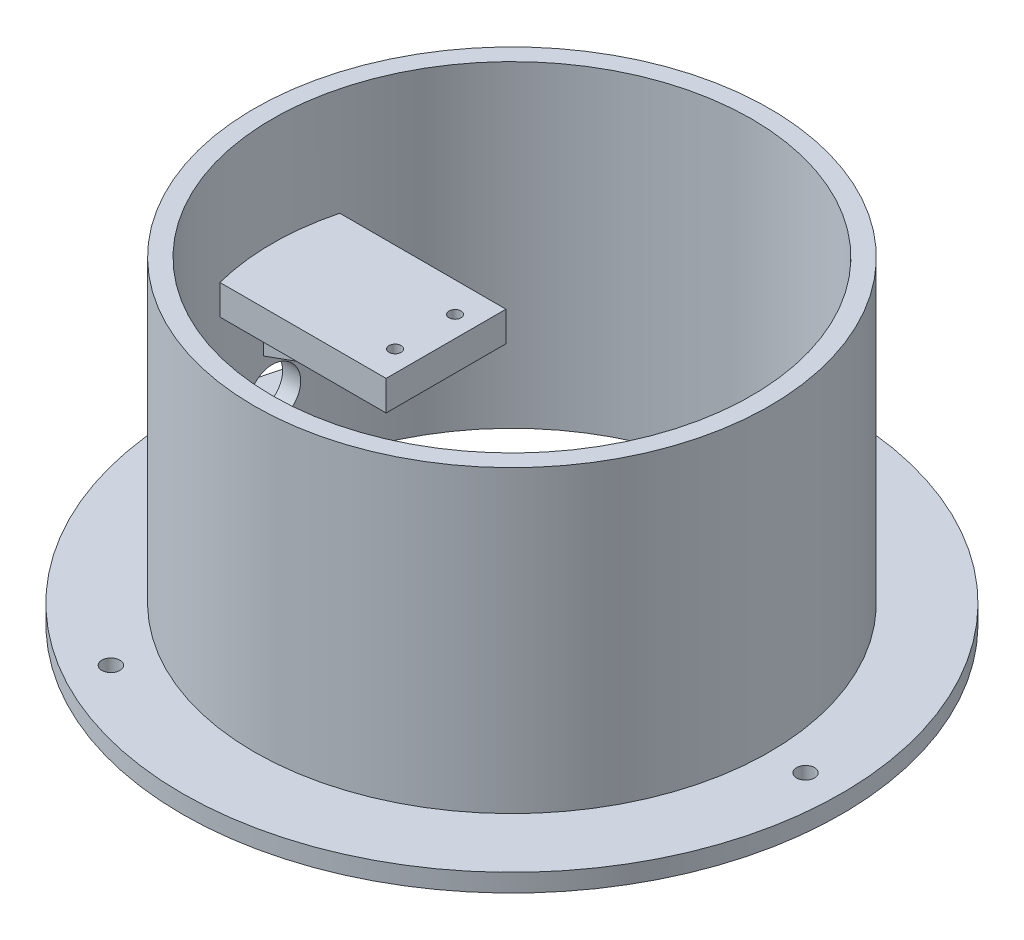
from build123d import *

# Parameters (mm, degrees)
SKETCH1_R           = 55
BOSS_EXTRUDE1_DEPTH = 3
SKETCH2_R           = 43
BOSS_EXTRUDE2_DEPTH = 50
SKETCH3_R           = 40
CUT_EXTRUDE1_DEPTH  = 66
SKETCH10_R          = 4.5
CUT_EXTRUDE2_DEPTH  = 9
BOSS_EXTRUDE4_DEPTH = 5
SKETCH17_W          = 10.5
SKETCH17_H          = 3
BOSS_EXTRUDE7_DEPTH = 10.5
CUT_EXTRUDE6_DEPTH  = 3
SKETCH19_W          = 29.5
SKETCH19_H          = 3
BOSS_EXTRUDE8_DEPTH = 10.5
CUT_EXTRUDE7_DEPTH  = 3
SKETCH21_R          = 1.5
CUT_EXTRUDE8_DEPTH  = 8
CIRPATTERN1_COUNT   = 3
SKETCH23_R          = 1
CUT_EXTRUDE9_DEPTH  = 9
SKETCH24_R          = 1
CUT_EXTRUDE10_DEPTH = 9


with BuildPart() as part:
    # Sketch1 → Boss-Extrude1 (new body)
    with BuildSketch(Plane(origin=(0, 0, 0), x_dir=(1, 0, 0), z_dir=(0, 1, 0))):
        with Locations(Location((0, 0, 0), (0, 0, 270))):
            Circle(SKETCH1_R)
    extrude(amount=BOSS_EXTRUDE1_DEPTH)

    # Sketch2 → Boss-Extrude2 (add)
    with BuildSketch(Plane(origin=(0, 3, 0), x_dir=(1, 0, 0), z_dir=(0, 1, 0))):
        with Locations(Location((0, 0, 0), (0, 0, 270))):
            Circle(SKETCH2_R)
    extrude(amount=BOSS_EXTRUDE2_DEPTH)

    # Sketch3 → Cut-Extrude1 (cut)
    with BuildSketch(Plane(origin=(0, 53, 0), x_dir=(1, 0, 0), z_dir=(0, 1, 0))):
        with Locations(Location((0, 0, 0), (0, 0, 270))):
            Circle(SKETCH3_R)
    extrude(amount=-CUT_EXTRUDE1_DEPTH, mode=Mode.SUBTRACT)

    # Sketch10 → Cut-Extrude2 (cut)
    with BuildSketch(Plane(origin=(-39, 0, 0), x_dir=(0, 0, -1), z_dir=(1, 0, 0))):
        with Locations((0, 13)):
            Circle(SKETCH10_R)
    extrude(amount=-CUT_EXTRUDE2_DEPTH, mode=Mode.SUBTRACT)

    # Sketch12 → Boss-Extrude4 (add)
    with BuildSketch(Plane(origin=(0, 35, 0), x_dir=(1, 0, 0), z_dir=(0, 1, 0))):
        with BuildLine():
            Line((-11, 10), (-39.761790704, 10))
            ThreePointArc((-39.761790704, 10), (-41, 0), (-39.761790704, -10))
            Line((-39.761790704, -10), (-11, -10))
            Line((-11, -10), (-11, 10))
        make_face()
        with BuildLine():
            Line((30, 10), (39.761790704, 10))
            ThreePointArc((39.761790704, 10), (41, 0), (39.761790704, -10))
            Line((39.761790704, -10), (30, -10))
            Line((30, -10), (30, 10))
        make_face()
    extrude(amount=-BOSS_EXTRUDE4_DEPTH)

    # Sketch17 → Boss-Extrude7 (add)
    with BuildSketch(Plane.XZ.offset(-30)):
        with Locations((35.25, 0)):
            Rectangle(SKETCH17_W, SKETCH17_H)
    extrude(amount=BOSS_EXTRUDE7_DEPTH)

    # Sketch18 → Cut-Extrude6 (cut)
    with BuildSketch(Plane.XY.offset(1.5)):
        Polygon((30, 30), (39.971865105, 19.5), (30, 19.5), align=None)
    extrude(amount=-CUT_EXTRUDE6_DEPTH, mode=Mode.SUBTRACT)

    # Sketch19 → Boss-Extrude8 (add)
    with BuildSketch(Plane.XZ.offset(-30)):
        with Locations((-25.75, 0)):
            Rectangle(SKETCH19_W, SKETCH19_H)
    extrude(amount=BOSS_EXTRUDE8_DEPTH)

    # Sketch20 → Cut-Extrude7 (cut)
    with BuildSketch(Plane.XY.offset(1.5)):
        Polygon((-39.971865105, 19.5), (-11, 30), (-11, 19.5), align=None)
    extrude(amount=-CUT_EXTRUDE7_DEPTH, mode=Mode.SUBTRACT)

    # Sketch21 → Cut-Extrude8 (cut)
    with BuildSketch(Plane(origin=(0, 3, 0), x_dir=(1, 0, 0), z_dir=(0, 1, 0))):
        with Locations(Location((49, 0, 0), (0, 0, 270))):
            Circle(SKETCH21_R)
    cut_extrude8 = extrude(amount=-CUT_EXTRUDE8_DEPTH, mode=Mode.SUBTRACT)

    # CirPattern1: Cut-Extrude8 ×3 about axis
    cirpattern1_axis = Axis((0, 0, 0), (0, 1, 0))
    for i in range(1, CIRPATTERN1_COUNT):
        add(cut_extrude8.rotate(cirpattern1_axis, i * 360 / CIRPATTERN1_COUNT), mode=Mode.SUBTRACT)

    # Sketch23 → Cut-Extrude9 (cut)
    with BuildSketch(Plane(origin=(0, 35, 0), x_dir=(1, 0, 0), z_dir=(0, 1, 0))):
        with Locations(Location((-14.5, 5, 0), (0, 0, 270))):
            Circle(SKETCH23_R)
        with Locations(Location((-14.5, -5, 0), (0, 0, 270))):
            Circle(SKETCH23_R)
    extrude(amount=-CUT_EXTRUDE9_DEPTH, mode=Mode.SUBTRACT)

    # Sketch24 → Cut-Extrude10 (cut)
    with BuildSketch(Plane(origin=(0, 35, 0), x_dir=(1, 0, 0), z_dir=(0, 1, 0))):
        with Locations(Location((33.5, 5, 0), (0, 0, 270))):
            Circle(SKETCH24_R)
        with Locations(Location((33.5, -5, 0), (0, 0, 270))):
            Circle(SKETCH24_R)
    extrude(amount=-CUT_EXTRUDE10_DEPTH, mode=Mode.SUBTRACT)


solid = part.part
